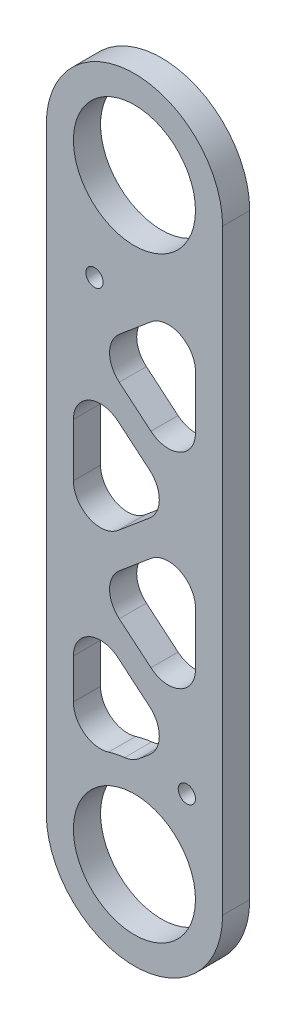
from build123d import *

# Parameters (mm, degrees)
SKETCH2_R               = 20.6375
SKETCH2_R_2             = 14.2875
BOSS_EXTRUDE1_DEPTH     = 3.175
CUT_EXTRUDE1_DEPTH      = 162.691375582
CUT_EXTRUDE1_DEPTH_BACK = 162.691375582
SKETCH3_R               = 2.0193
FILLET2_R               = 6.35


with BuildPart() as part:
    # Sketch2 → Boss-Extrude1 (new, symmetric)
    # profile 1 of 3: a face of its own
    with BuildSketch(Plane.XY):
        with BuildLine():
            Line((20.6375, 0), (20.6375, 139.7))
            ThreePointArc((20.6375, 139.7), (0, 119.0625), (-20.6375, 139.7))
            Line((-20.6375, 139.7), (-20.6375, 0))
            ThreePointArc((-20.6375, 0), (0, 20.6375), (20.6375, 0))
        make_face()
    # profile 2 of 3: a face of its own
    with BuildSketch(Plane.XY):
        with Locations((0, 139.7)):
            Circle(SKETCH2_R)
        with Locations((0, 139.7)):
            Circle(SKETCH2_R_2, mode=Mode.SUBTRACT)
    # profile 3 of 3: a face of its own
    with BuildSketch(Plane.XY):
        Circle(SKETCH2_R)
        Circle(SKETCH2_R_2, mode=Mode.SUBTRACT)
    extrude(amount=BOSS_EXTRUDE1_DEPTH, both=True)

    # Sketch3 → Cut-Extrude1 (cut, two sides: drawn at the far end of the back side and taken through both)
    with BuildSketch(Plane.XY.offset(-CUT_EXTRUDE1_DEPTH_BACK)):
        Polygon((14.2875, 80.998054184), (14.2875, 120.663261819), (-9.34807685, 100.830658002), align=None)
        Polygon((9.34807685, 76.853386041), (-14.2875, 96.685989858), (-14.2875, 57.020782224), align=None)
        Polygon((14.2875, 33.043510263), (14.2875, 72.708717897), (-9.34807685, 52.87611408), align=None)
        with BuildLine():
            Line((9.34807685, 28.898842119), (-14.2875, 48.731445936))
            Line((-14.2875, 48.731445936), (-14.2875, 14.892070037))
            ThreePointArc((-14.2875, 14.892070037), (-7.933318425, 19.051741785), (-0.504765013, 20.631326146))
            Line((-0.504765013, 20.631326146), (9.34807685, 28.898842119))
        make_face()
        with Locations((-9.34807685, 114.324408002)):
            Circle(SKETCH3_R)
        with Locations((12.2682, 20.423771151)):
            Circle(SKETCH3_R)
    extrude(amount=CUT_EXTRUDE1_DEPTH + CUT_EXTRUDE1_DEPTH_BACK, mode=Mode.SUBTRACT)

    # Fillet2
    fillet2_edges = [part.edges().sort_by_distance(p)[0] for p in [
        (-0.504765013, 20.631326146, 0),
        (-14.2875, 14.892070037, 0),
        (-14.2875, 48.731445936, 0),
        (9.34807685, 28.898842119, 0),
        (9.34807685, 76.853386041, 0),
        (-14.2875, 57.020782224, 0),
        (-14.2875, 96.685989858, 0),
        (-9.34807685, 52.87611408, 0),
        (14.2875, 72.708717897, 0),
        (14.2875, 33.043510263, 0),
        (-9.34807685, 100.830658002, 0),
        (14.2875, 120.663261819, 0),
        (14.2875, 80.998054184, 0),
    ]]
    fillet(fillet2_edges, radius=FILLET2_R)


solid = part.part
